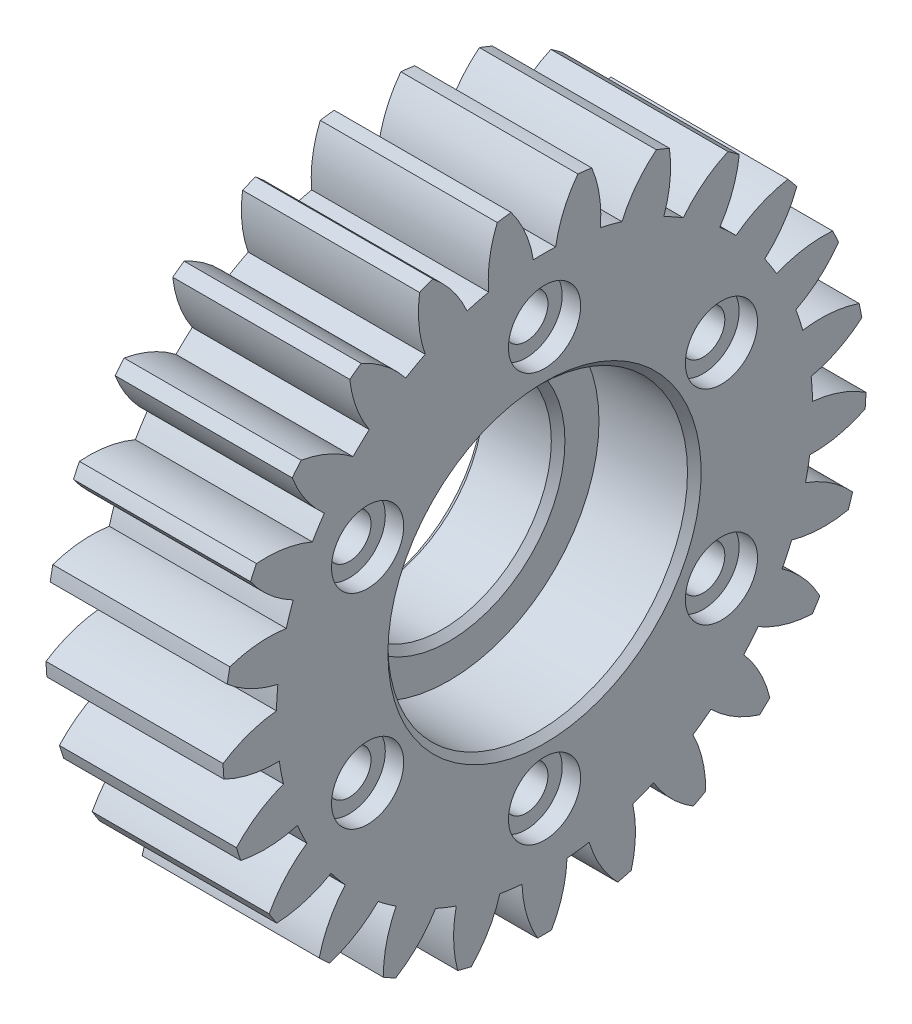
from build123d import *

# Parameters (mm, degrees)
BASPROSKE_W        = 13
BASPROSKE_H        = 23.625
TOOTHCUT_DEPTH     = 36.850819377
TEETHCUTS_COUNT    = 25
TEETHCUTS_ANGLE    = 345.6
BORSKE_R           = 4
BORE_DEPTH         = 50.0000508
SKETCH1_R          = 11
CUT_EXTRUDE1_DEPTH = 7
CUT_EXTRUDE2_REACH = 36.122
SKETCH2_R          = 8
CUT_EXTRUDE3_REACH = 37.838
SKETCH3_R          = 1.6
CIRPATTERN1_COUNT  = 6
CHAMFER1_SIZE      = 0.5
CUT_EXTRUDE4_DEPTH = 2.3
SKETCH6_R          = 2.65
CUT_EXTRUDE5_DEPTH = 1.35
CIRPATTERN2_COUNT  = 6


with BuildPart() as part:
    # BasProSke → Base-Revolve (revolve)
    with BuildSketch(Plane(origin=(0, 0, 0), x_dir=(1, 0, 0), z_dir=(0, 1, 0)), mode=Mode.PRIVATE) as base_revolve_sk:
        with Locations((6.5, 11.8125)):
            Rectangle(BASPROSKE_W, BASPROSKE_H)
    revolve(base_revolve_sk.sketch.rotate(Axis((-10, 0, 0), (1, 0, 0)), 180), axis=Axis((-10, 0, 0), (1, 0, 0)))

    # TooCutSke → ToothCut (cut, through all)
    with BuildSketch(Plane(origin=(0, 0, 0), x_dir=(0, 0, -1), z_dir=(1, 0, 0))):
        with BuildLine():
            ThreePointArc((0.818998709, 19.669456611), (0, 19.6865), (-0.818998709, 19.669456611))
            ThreePointArc((-0.818998709, 19.669456611), (-1.409254574, 21.695516899), (-2.467415344, 23.521336732))
            ThreePointArc((-2.467415344, 23.521336732), (0, 23.6504), (2.467415344, 23.521336732))
            ThreePointArc((2.467415344, 23.521336732), (1.409254574, 21.695516899), (0.818998709, 19.669456611))
        make_face()
    toothcut = extrude(amount=TOOTHCUT_DEPTH, mode=Mode.SUBTRACT)

    # TeethCuts: ToothCut ×25 about axis
    teethcuts_axis = Axis((-10, 0, 0), (1, 0, 0))
    for i in range(1, TEETHCUTS_COUNT):
        add(toothcut.rotate(teethcuts_axis, i * TEETHCUTS_ANGLE / (TEETHCUTS_COUNT - 1)), mode=Mode.SUBTRACT)

    # BorSke → Bore (cut, symmetric)
    with BuildSketch(Plane(origin=(0, 0, 0), x_dir=(0, 0, -1), z_dir=(1, 0, 0))):
        with Locations(Location((0, 0, 0), (0, 0, 180))):
            Circle(BORSKE_R)
    extrude(amount=BORE_DEPTH, both=True, mode=Mode.SUBTRACT)

    # Sketch1 → Cut-Extrude1 (cut)
    with BuildSketch(Plane(origin=(13, 0, 0), x_dir=(0, 0, -1), z_dir=(1, 0, 0))):
        Circle(SKETCH1_R)
    extrude(amount=-CUT_EXTRUDE1_DEPTH, mode=Mode.SUBTRACT)

    # Sketch2 → Cut-Extrude2 (cut, up to next)
    with BuildSketch(Plane(origin=(6, 0, 0), x_dir=(0, 0, -1), z_dir=(1, 0, 0)), mode=Mode.PRIVATE) as cut_extrude2_sk1:
        Circle(SKETCH2_R)
    cut_extrude2_tool1 = extrude(cut_extrude2_sk1.sketch, amount=-CUT_EXTRUDE2_REACH, mode=Mode.PRIVATE) & part.part
    add(cut_extrude2_tool1.solids().sort_by_distance((6, 0, 0))[0], mode=Mode.SUBTRACT)

    # Sketch3 → Cut-Extrude3 (cut, up to next)
    with BuildSketch(Plane(origin=(13, 0, 0), x_dir=(0, 0, -1), z_dir=(1, 0, 0)), mode=Mode.PRIVATE) as cut_extrude3_sk1:
        with Locations((0, 15)):
            Circle(SKETCH3_R)
    cut_extrude3_tool1 = extrude(cut_extrude3_sk1.sketch, amount=-CUT_EXTRUDE3_REACH, mode=Mode.PRIVATE) & part.part
    cut_extrude3 = cut_extrude3_tool1.solids().sort_by_distance((13, 15, 0))[0]
    add(cut_extrude3, mode=Mode.SUBTRACT)

    # CirPattern1: Cut-Extrude3 ×6 about axis
    cirpattern1_axis = Axis((0, 0, 0), (1, 0, 0))
    for i in range(1, CIRPATTERN1_COUNT):
        add(cut_extrude3.rotate(cirpattern1_axis, i * 360 / CIRPATTERN1_COUNT), mode=Mode.SUBTRACT)

    # Chamfer1
    chamfer1_edges = [part.edges().sort_by_distance(p)[0] for p in [
        (13, 0, 11),
        (6, 0, 8),
        (0, 0, 8),
    ]]
    chamfer(chamfer1_edges, length=CHAMFER1_SIZE)

    # Sketch4 → Cut-Extrude4 (cut)
    with BuildSketch(Plane.ZY):
        Polygon((1.616580754, 17.8), (-1.616580754, 17.8), (-3.233161507, 15), (-1.616580754, 12.2), (1.616580754, 12.2), (3.233161507, 15), align=None)
        Polygon((-11.373800303, 10.3), (-14.60696181, 10.3), (-16.223542564, 7.5), (-14.60696181, 4.7), (-11.373800303, 4.7), (-9.757219549, 7.5), align=None)
        Polygon((11.373800303, 10.3), (9.757219549, 7.5), (11.373800303, 4.7), (14.60696181, 4.7), (16.223542564, 7.5), (14.60696181, 10.3), align=None)
    cut_extrude4 = extrude(amount=-CUT_EXTRUDE4_DEPTH, mode=Mode.SUBTRACT)

    # Mirror1: Cut-Extrude4 across plane
    add(cut_extrude4.mirror(Plane.ZX), mode=Mode.SUBTRACT)

    # Sketch6 → Cut-Extrude5 (cut)
    with BuildSketch(Plane(origin=(13, 0, 0), x_dir=(0, 0, -1), z_dir=(1, 0, 0))):
        with Locations((0, 15)):
            Circle(SKETCH6_R)
    cut_extrude5 = extrude(amount=-CUT_EXTRUDE5_DEPTH, mode=Mode.SUBTRACT)

    # CirPattern2: Cut-Extrude5 ×6 about axis
    cirpattern2_axis = Axis((0, 0, 0), (1, 0, 0))
    for i in range(1, CIRPATTERN2_COUNT):
        add(cut_extrude5.rotate(cirpattern2_axis, i * 360 / CIRPATTERN2_COUNT), mode=Mode.SUBTRACT)


solid = part.part
